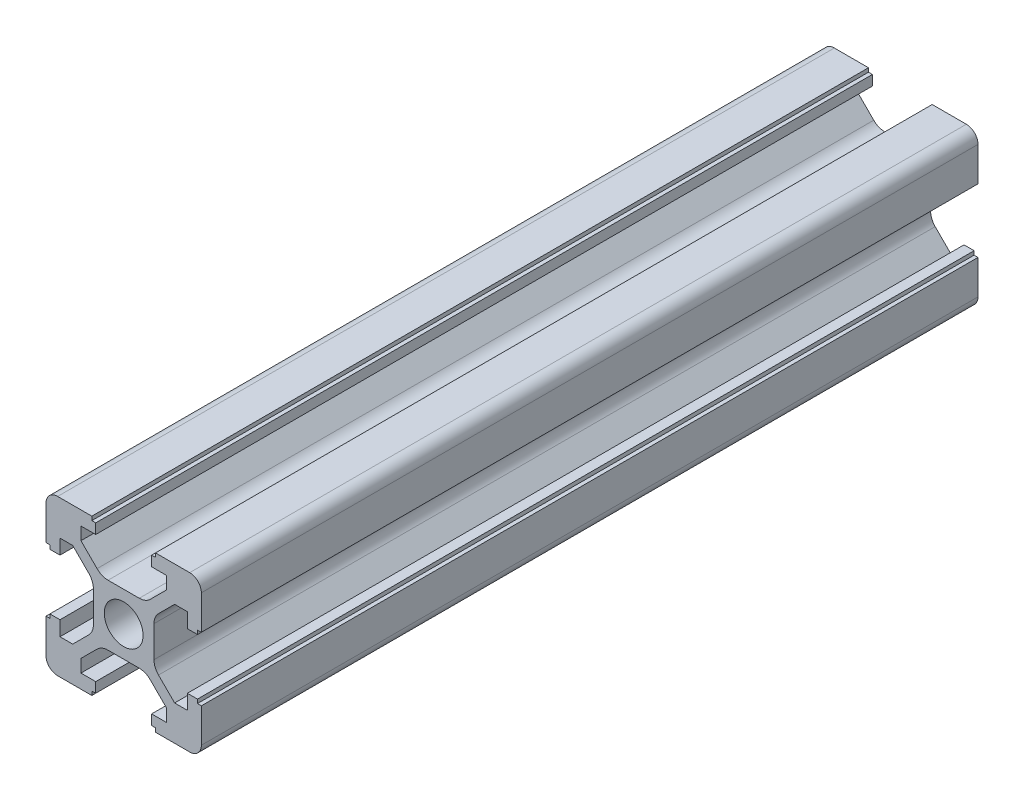
from build123d import *

# Parameters (mm, degrees)
SKETCH1_R           = 2.5
BOSS_EXTRUDE2_DEPTH = 100


with BuildPart() as part:
    # Sketch1 → Boss-Extrude2 (new body)
    with BuildSketch(Plane.XY):
        with BuildLine():
            Line((10, -4.1), (10, -8.5))
            ThreePointArc((10, -8.5), (9.560660172, -9.560660172), (8.5, -10))
            Line((8.5, -10), (4.1, -10))
            Line((4.1, -10), (4.1, -9.5))
            Line((4.1, -9.5), (3.6, -9.5))
            Line((3.6, -9.5), (3.6, -8.2))
            Line((3.6, -8.2), (5.5, -8.2))
            Line((5.5, -8.2), (5.5, -6.560660172))
            Line((5.5, -6.560660172), (3.425126266, -4.485786438))
            ThreePointArc((3.425126266, -4.485786438), (2.776279568, -4.052240935), (2.010912703, -3.9))
            Line((2.010912703, -3.9), (-2.010912703, -3.9))
            ThreePointArc((-2.010912703, -3.9), (-2.776279568, -4.052240935), (-3.425126266, -4.485786438))
            Line((-3.425126266, -4.485786438), (-5.5, -6.560660172))
            Line((-5.5, -6.560660172), (-5.5, -8.2))
            Line((-5.5, -8.2), (-3.6, -8.2))
            Line((-3.6, -8.2), (-3.6, -9.5))
            Line((-3.6, -9.5), (-4.1, -9.5))
            Line((-4.1, -9.5), (-4.1, -10))
            Line((-4.1, -10), (-8.5, -10))
            ThreePointArc((-8.5, -10), (-9.560660172, -9.560660172), (-10, -8.5))
            Line((-10, -8.5), (-10, -4.1))
            Line((-10, -4.1), (-9.5, -4.1))
            Line((-9.5, -4.1), (-9.5, -3.6))
            Line((-9.5, -3.6), (-8.2, -3.6))
            Line((-8.2, -3.6), (-8.2, -5.5))
            Line((-8.2, -5.5), (-6.560660172, -5.5))
            Line((-6.560660172, -5.5), (-4.485786438, -3.425126266))
            ThreePointArc((-4.485786438, -3.425126266), (-4.052240935, -2.776279568), (-3.9, -2.010912703))
            Line((-3.9, -2.010912703), (-3.9, 2.010912703))
            ThreePointArc((-3.9, 2.010912703), (-4.052240935, 2.776279568), (-4.485786438, 3.425126266))
            Line((-4.485786438, 3.425126266), (-6.560660172, 5.5))
            Line((-6.560660172, 5.5), (-8.2, 5.5))
            Line((-8.2, 5.5), (-8.2, 3.6))
            Line((-8.2, 3.6), (-9.5, 3.6))
            Line((-9.5, 3.6), (-9.5, 4.1))
            Line((-9.5, 4.1), (-10, 4.1))
            Line((-10, 4.1), (-10, 8.5))
            ThreePointArc((-10, 8.5), (-9.560660172, 9.560660172), (-8.5, 10))
            Line((-8.5, 10), (-4.1, 10))
            Line((-4.1, 10), (-4.1, 9.5))
            Line((-4.1, 9.5), (-3.6, 9.5))
            Line((-3.6, 9.5), (-3.6, 8.2))
            Line((-3.6, 8.2), (-5.5, 8.2))
            Line((-5.5, 8.2), (-5.5, 6.560660172))
            Line((-5.5, 6.560660172), (-3.425126266, 4.485786438))
            ThreePointArc((-3.425126266, 4.485786438), (-2.776279568, 4.052240935), (-2.010912703, 3.9))
            Line((-2.010912703, 3.9), (2.010912703, 3.9))
            ThreePointArc((2.010912703, 3.9), (2.776279568, 4.052240935), (3.425126266, 4.485786438))
            Line((3.425126266, 4.485786438), (5.5, 6.560660172))
            Line((5.5, 6.560660172), (5.5, 8.2))
            Line((5.5, 8.2), (3.6, 8.2))
            Line((3.6, 8.2), (3.6, 9.5))
            Line((3.6, 9.5), (4.1, 9.5))
            Line((4.1, 9.5), (4.1, 10))
            Line((4.1, 10), (8.5, 10))
            ThreePointArc((8.5, 10), (9.560660172, 9.560660172), (10, 8.5))
            Line((10, 8.5), (10, 4.1))
            Line((10, 4.1), (9.5, 4.1))
            Line((9.5, 4.1), (9.5, 3.6))
            Line((9.5, 3.6), (8.2, 3.6))
            Line((8.2, 3.6), (8.2, 5.5))
            Line((8.2, 5.5), (6.560660172, 5.5))
            Line((6.560660172, 5.5), (4.485786438, 3.425126266))
            ThreePointArc((4.485786438, 3.425126266), (4.052240935, 2.776279568), (3.9, 2.010912703))
            Line((3.9, 2.010912703), (3.9, -2.010912703))
            ThreePointArc((3.9, -2.010912703), (4.052240935, -2.776279568), (4.485786438, -3.425126266))
            Line((4.485786438, -3.425126266), (6.560660172, -5.5))
            Line((6.560660172, -5.5), (8.2, -5.5))
            Line((8.2, -5.5), (8.2, -3.6))
            Line((8.2, -3.6), (9.5, -3.6))
            Line((9.5, -3.6), (9.5, -4.1))
            Line((9.5, -4.1), (10, -4.1))
        make_face()
        Circle(SKETCH1_R, mode=Mode.SUBTRACT)
    extrude(amount=BOSS_EXTRUDE2_DEPTH)


solid = part.part
